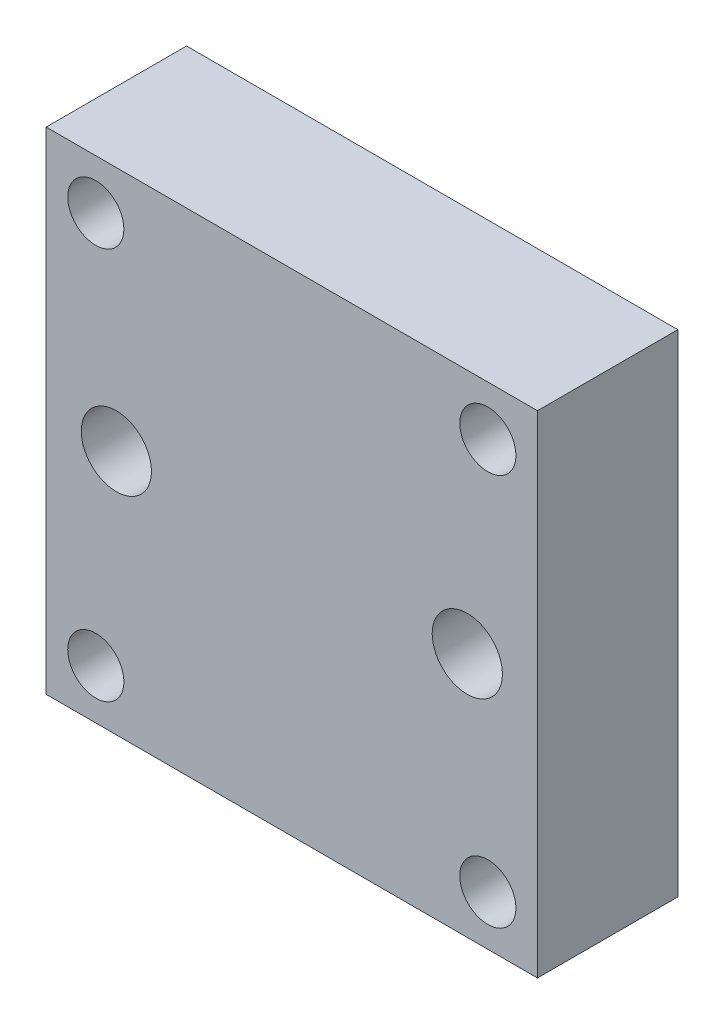
from build123d import *

# Parameters (mm, degrees)
SKETCH1_W           = 35
SKETCH1_H           = 35
SKETCH1_R           = 2
SKETCH1_R_2         = 2.5
BOSS_EXTRUDE1_DEPTH = 10


with BuildPart() as part:
    # Sketch1 → Boss-Extrude1 (new body)
    with BuildSketch(Plane.XY):
        with Locations((2.777777778, 2.470273614)):
            Rectangle(SKETCH1_W, SKETCH1_H)
        with Locations((16.742243872, -11.49419248)):
            Circle(SKETCH1_R, mode=Mode.SUBTRACT)
        with Locations(Location((16.742243872, 16.434739708, 0), (0, 0, 180))):
            Circle(SKETCH1_R, mode=Mode.SUBTRACT)
        with Locations((-11.186688316, 16.434739708)):
            Circle(SKETCH1_R, mode=Mode.SUBTRACT)
        with Locations(Location((-11.186688316, -11.49419248, 0), (0, 0, 180))):
            Circle(SKETCH1_R, mode=Mode.SUBTRACT)
        with Locations(Location((15.277777778, 2.470273614, 0), (0, 0, 180))):
            Circle(SKETCH1_R_2, mode=Mode.SUBTRACT)
        with Locations((-9.722222222, 2.470273614)):
            Circle(SKETCH1_R_2, mode=Mode.SUBTRACT)
    extrude(amount=BOSS_EXTRUDE1_DEPTH)


solid = part.part
